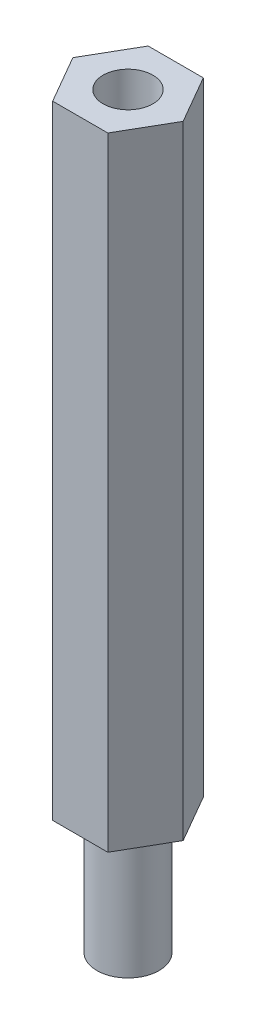
from build123d import *

# Parameters (mm, degrees)
SKETCH1_R           = 1.2
BOSS_EXTRUDE1_DEPTH = 30
SKETCH3_R           = 1.5
BOSS_EXTRUDE2_DEPTH = 6


with BuildPart() as part:
    # Sketch1 → Boss-Extrude1 (new body)
    with BuildSketch(Plane(origin=(0, 0, 0), x_dir=(1, 0, 0), z_dir=(0, 1, 0))):
        Polygon((2.655811238, 0), (1.327905619, 2.3), (-1.327905619, 2.3), (-2.655811238, 0), (-1.327905619, -2.3), (1.327905619, -2.3), align=None)
        with Locations(Location((0, 0, 0), (0, 0, 270))):
            Circle(SKETCH1_R, mode=Mode.SUBTRACT)
    extrude(amount=BOSS_EXTRUDE1_DEPTH)

    # Sketch3 → Boss-Extrude2 (add)
    with BuildSketch(Plane(origin=(0, 0, 0), x_dir=(-1, 0, 0), z_dir=(0, -1, 0))):
        with Locations(Location((0, 0, 0), (0, 0, 270))):
            Circle(SKETCH3_R)
    extrude(amount=BOSS_EXTRUDE2_DEPTH)


solid = part.part
